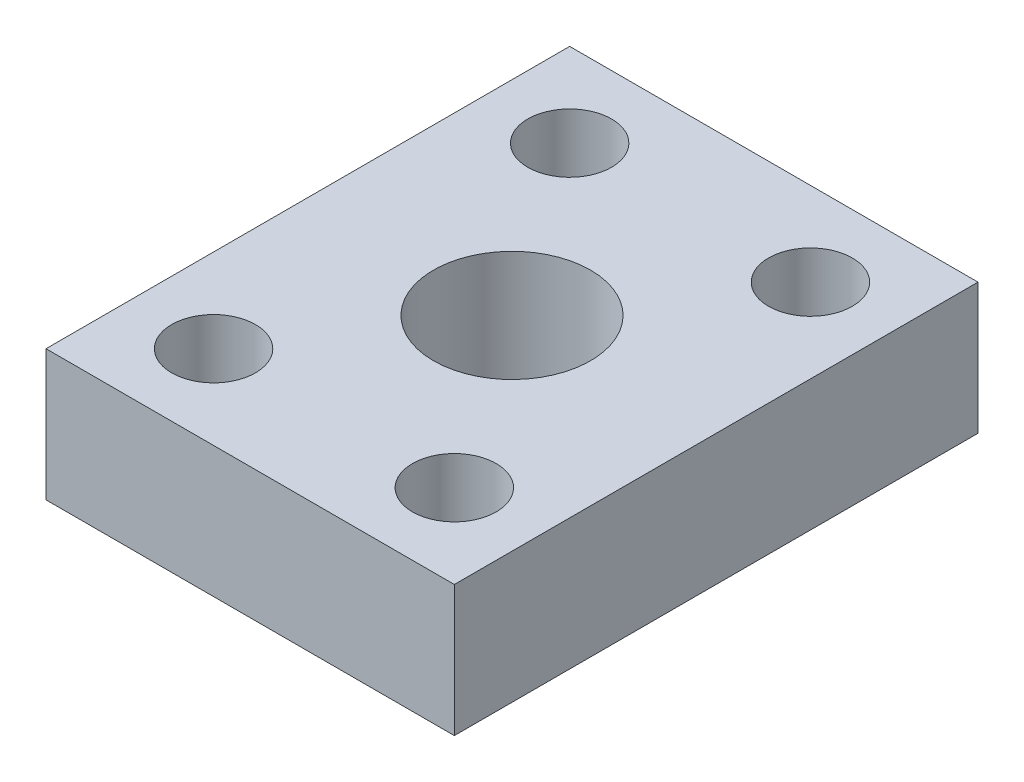
from build123d import *

# Parameters (mm, degrees)
SKETCH1_W           = 9.903087186
SKETCH1_H           = 12.7
SKETCH1_R           = 1.905
SKETCH1_R_2         = 1.016
BOSS_EXTRUDE1_DEPTH = 3.175


with BuildPart() as part:
    # Sketch1 → Boss-Extrude1 (new body)
    with BuildSketch(Plane(origin=(0, 0, 0), x_dir=(1, 0, 0), z_dir=(0, 1, 0))):
        with Locations((12.571543593, 0)):
            Rectangle(SKETCH1_W, SKETCH1_H)
        with Locations(Location((12.571543593, 0, 0), (0, 0, 270))):
            Circle(SKETCH1_R, mode=Mode.SUBTRACT)
        with Locations(Location((15.491087186, 4.318, 0), (0, 0, 270))):
            Circle(SKETCH1_R_2, mode=Mode.SUBTRACT)
        with Locations(Location((9.652, 4.318, 0), (0, 0, 270))):
            Circle(SKETCH1_R_2, mode=Mode.SUBTRACT)
        with Locations(Location((9.652, -4.318, 0), (0, 0, 270))):
            Circle(SKETCH1_R_2, mode=Mode.SUBTRACT)
        with Locations(Location((15.491087186, -4.318, 0), (0, 0, 270))):
            Circle(SKETCH1_R_2, mode=Mode.SUBTRACT)
    extrude(amount=BOSS_EXTRUDE1_DEPTH)


solid = part.part
